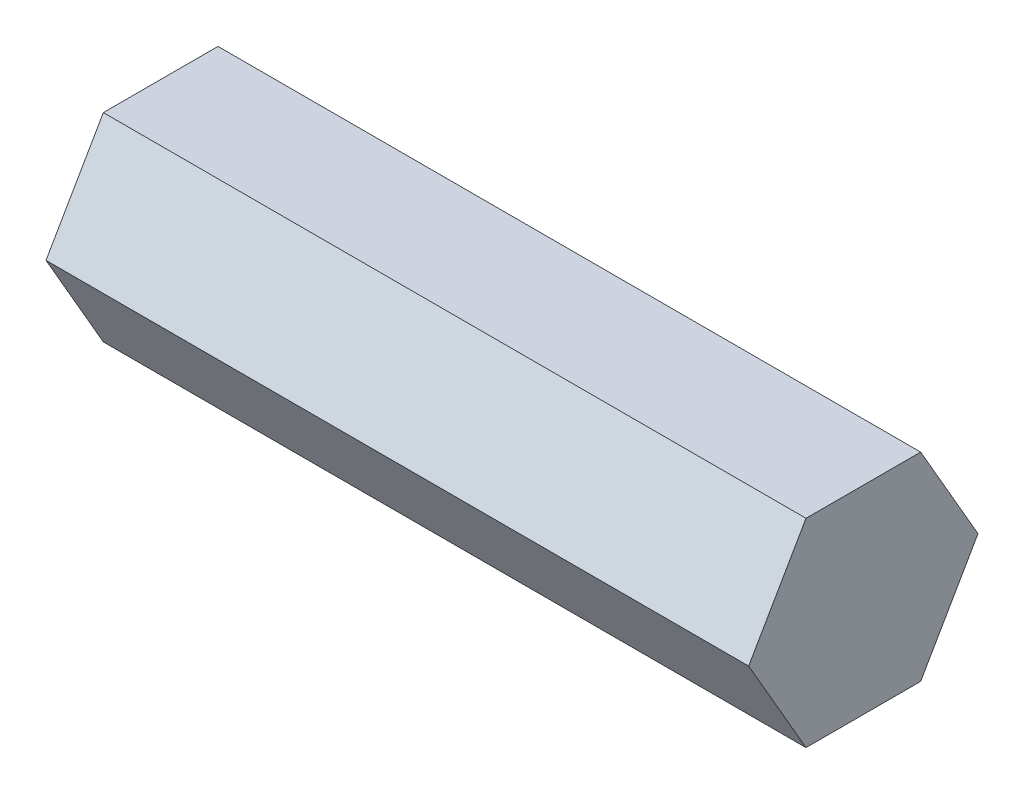
from build123d import *

# Parameters (mm, degrees)
SALIENTE_EXTRUIR1_DEPTH = 44.935


with BuildPart() as part:
    # Croquis2 → Saliente-Extruir1 (new body)
    with BuildSketch(Plane(origin=(0, 0, 0), x_dir=(0, 0, -1), z_dir=(1, 0, 0))):
        Polygon((7.332348419, 0), (3.666174209, 6.35), (-3.666174209, 6.35), (-7.332348419, 0), (-3.666174209, -6.35), (3.666174209, -6.35), align=None)
    extrude(amount=SALIENTE_EXTRUIR1_DEPTH)


solid = part.part
